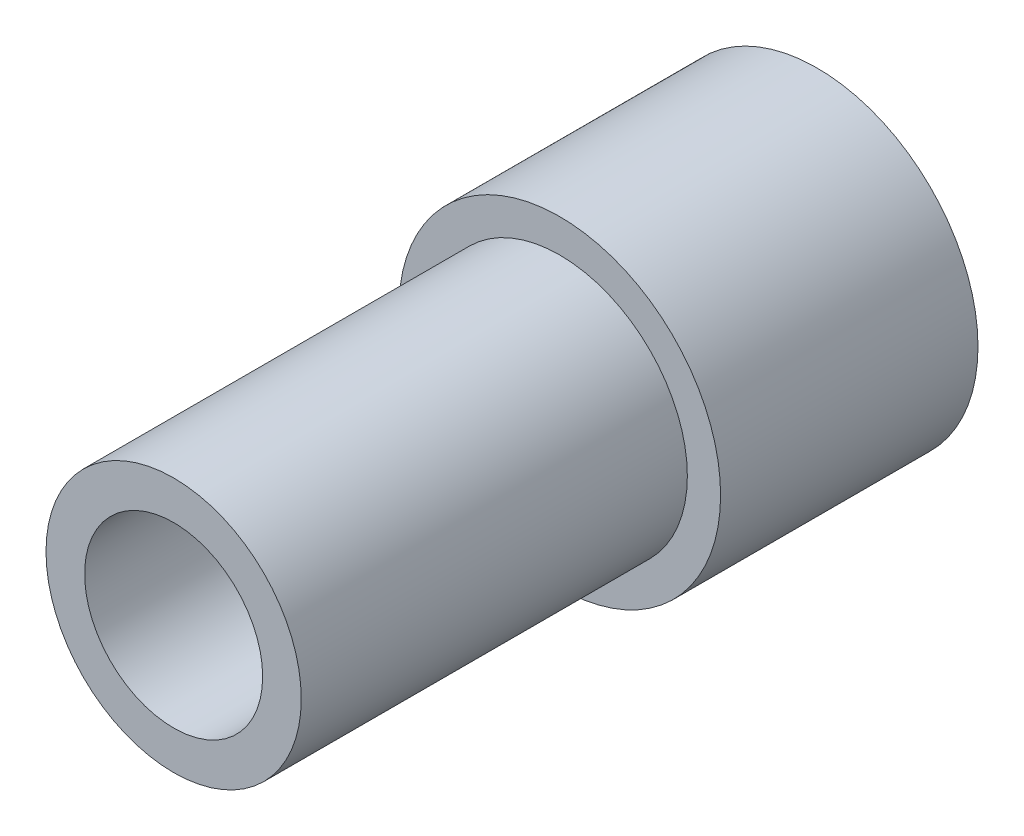
from build123d import *

# Parameters (mm, degrees)
SKETCH1_R           = 7.5
SKETCH1_R_2         = 4.15
BOSS_EXTRUDE1_DEPTH = 30
CUT_EXTRUDE1_START  = -18
SKETCH2_R           = 7.5
SKETCH2_R_2         = 5.95
CUT_EXTRUDE1_DEPTH  = 18


with BuildPart() as part:
    # Sketch1 → Boss-Extrude1 (new body)
    with BuildSketch(Plane.XY):
        Circle(SKETCH1_R)
        Circle(SKETCH1_R_2, mode=Mode.SUBTRACT)
    extrude(amount=BOSS_EXTRUDE1_DEPTH)

    # Sketch2 → Cut-Extrude1 (cut)
    with BuildSketch(Plane.XY.offset(30).offset(CUT_EXTRUDE1_START)):
        Circle(SKETCH2_R)
        Circle(SKETCH2_R_2, mode=Mode.SUBTRACT)
    extrude(amount=CUT_EXTRUDE1_DEPTH, mode=Mode.SUBTRACT)


solid = part.part
